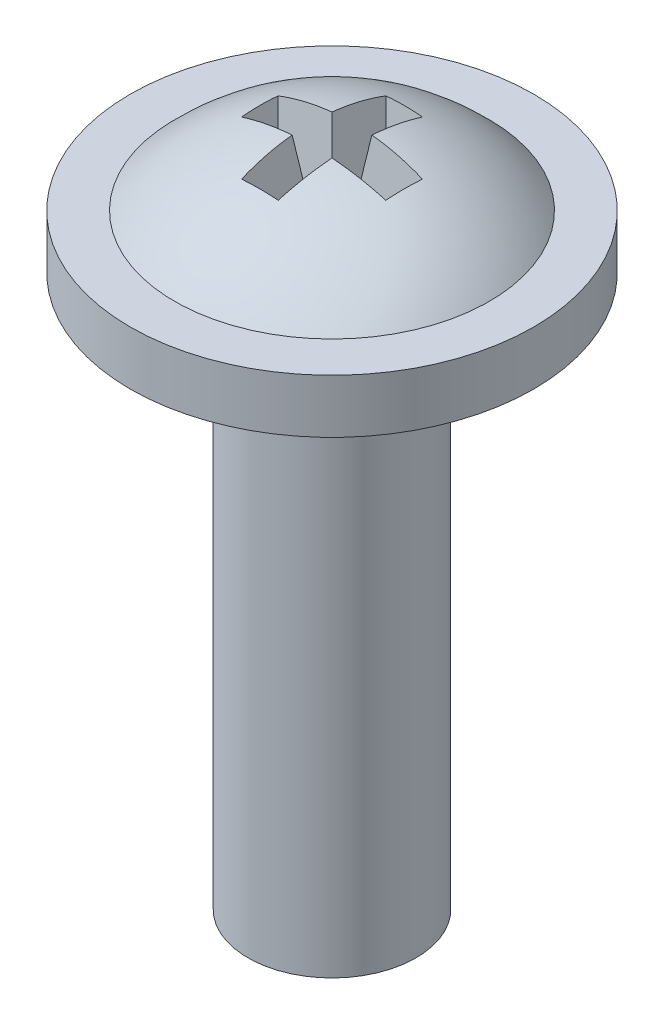
from build123d import *

# Parameters (mm, degrees)
CUT_EXTRUDE1_DEPTH = 2.032
CUT_EXTRUDE1_DRAFT = -8


with BuildPart() as part:
    # Sketch1 → Base-Revolve (revolve)
    with BuildSketch(Plane.XY, mode=Mode.PRIVATE) as base_revolve_sk:
        with BuildLine():
            Line((0, 0), (1.5875, 0))
            Line((1.5875, 0), (1.5875, 10.414))
            Line((1.5875, 10.414), (3.81, 10.414))
            Line((3.81, 10.414), (3.81, 11.43))
            Line((3.81, 11.43), (2.9718, 11.43))
            ThreePointArc((2.9718, 11.43), (1.615897215, 12.369193484), (0, 12.7))
            Line((0, 12.7), (0, 0))
        make_face()
    revolve(base_revolve_sk.sketch.rotate(Axis((0, 0, 0), (0, 1, 0)), 90), axis=Axis((0, 0, 0), (0, 1, 0)))


with BuildPart() as cut_extrude1_tool:
    # Sketch2 → Cut-Extrude1 (with draft: the straight prism first)
    with BuildSketch(Plane(origin=(0, 12.7, 0), x_dir=(-1, 0, 0), z_dir=(0, 1, 0))):
        Polygon((0.381, 1.397), (-0.381, 1.397), (-0.381, 0.381), (-1.397, 0.381), (-1.397, -0.381), (-0.381, -0.381), (-0.381, -1.397), (0.381, -1.397), (0.381, -0.381), (1.397, -0.381), (1.397, 0.381), (0.381, 0.381), align=None)
    extrude(amount=-CUT_EXTRUDE1_DEPTH)
    # Cut-Extrude1: the draft: its side faces are tilted about the plane it starts from
    cut_extrude1_sides = [cut_extrude1_tool.faces().sort_by_distance(p)[0] for p in [
        (0, 11.684, 1.397),
        (0.381, 11.684, 0.889),
        (0.889, 11.684, 0.381),
        (1.397, 11.684, 0),
        (0.889, 11.684, -0.381),
        (0.381, 11.684, -0.889),
        (0, 11.684, -1.397),
        (-0.381, 11.684, -0.889),
        (-0.889, 11.684, -0.381),
        (-1.397, 11.684, 0),
        (-0.889, 11.684, 0.381),
        (-0.381, 11.684, 0.889),
    ]]
    draft(cut_extrude1_sides, Plane(origin=(0, 12.7, 0), x_dir=(-1, 0, 0), z_dir=(0, 1, 0)), CUT_EXTRUDE1_DRAFT)


with BuildPart() as part_1:
    add(part.part)

    # Cut-Extrude1: cut by cut_extrude1_tool
    add(cut_extrude1_tool.part, mode=Mode.SUBTRACT)


solid = part_1.part
